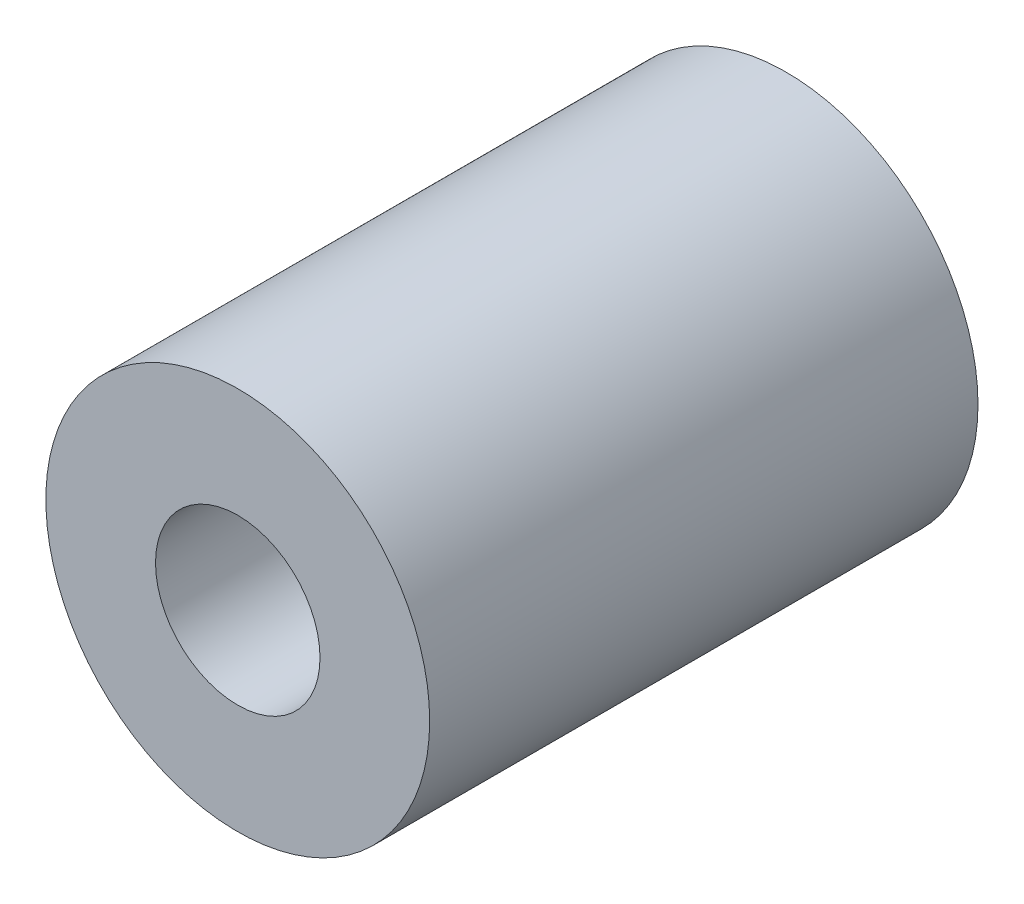
from build123d import *

# Parameters (mm, degrees)
SKETCH_1_R      = 3.5
SKETCH_1_R_2    = 1.5
EXTRUDE_1_DEPTH = 10


with BuildPart() as part:
    # 草图1 → 凸台-拉伸1 (new body)
    with BuildSketch(Plane.XY):
        Circle(SKETCH_1_R)
        Circle(SKETCH_1_R_2, mode=Mode.SUBTRACT)
    extrude(amount=EXTRUDE_1_DEPTH)


solid = part.part
